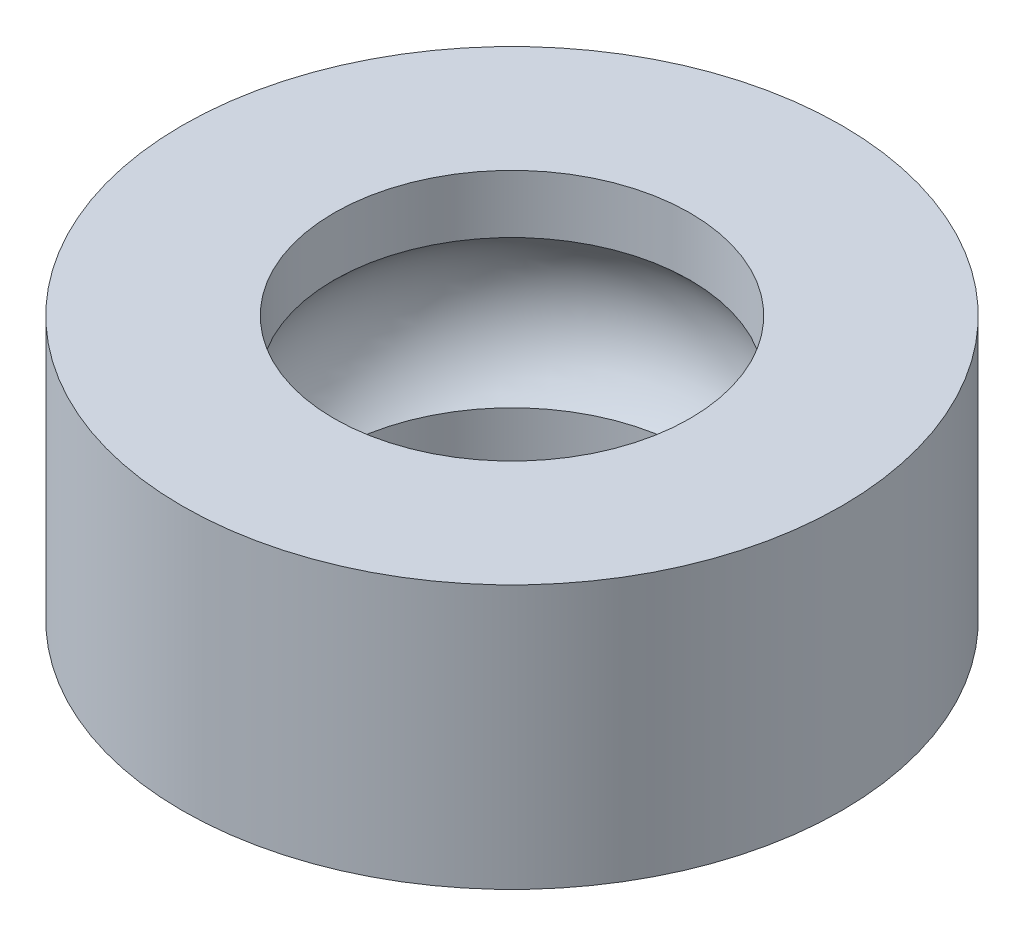
from build123d import *


with BuildPart() as part:
    # Sketch1 → Revolve1 (revolve)
    with BuildSketch(Plane.XY, mode=Mode.PRIVATE) as revolve1_sk:
        with BuildLine():
            Line((2.7, 4), (2.7, 3.118033989))
            ThreePointArc((2.7, 3.118033989), (3.2, 2), (2.7, 0.881966011))
            Line((2.7, 0.881966011), (2.7, 0))
            Line((2.7, 0), (5, 0))
            Line((5, 0), (5, 4))
            Line((5, 4), (2.7, 4))
        make_face()
    revolve(revolve1_sk.sketch.rotate(Axis((0, 0, 0), (0, 1, 0)), 90), axis=Axis((0, 0, 0), (0, 1, 0)))


solid = part.part
